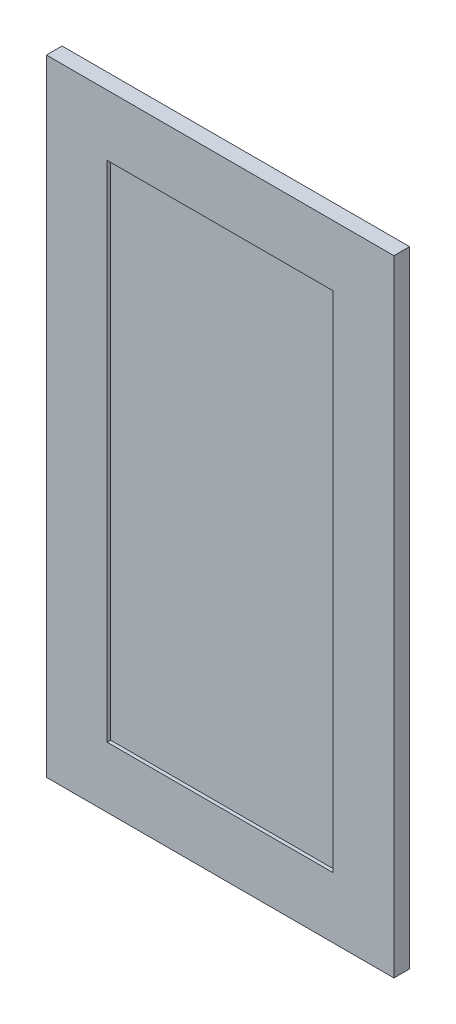
from build123d import *

# Parameters (mm, degrees)
SKETCH1_W           = 400
SKETCH1_H           = 720
BOSS_EXTRUDE1_DEPTH = 18
SKETCH2_W           = 260
SKETCH2_H           = 580
CUT_EXTRUDE1_DEPTH  = 4


with BuildPart() as part:
    # Sketch1 → Boss-Extrude1 (new body)
    with BuildSketch(Plane.XY):
        Rectangle(SKETCH1_W, SKETCH1_H)
    extrude(amount=BOSS_EXTRUDE1_DEPTH)

    # Sketch2 → Cut-Extrude1 (cut)
    with BuildSketch(Plane.XY.offset(18)):
        Rectangle(SKETCH2_W, SKETCH2_H)
    extrude(amount=-CUT_EXTRUDE1_DEPTH, mode=Mode.SUBTRACT)


solid = part.part
